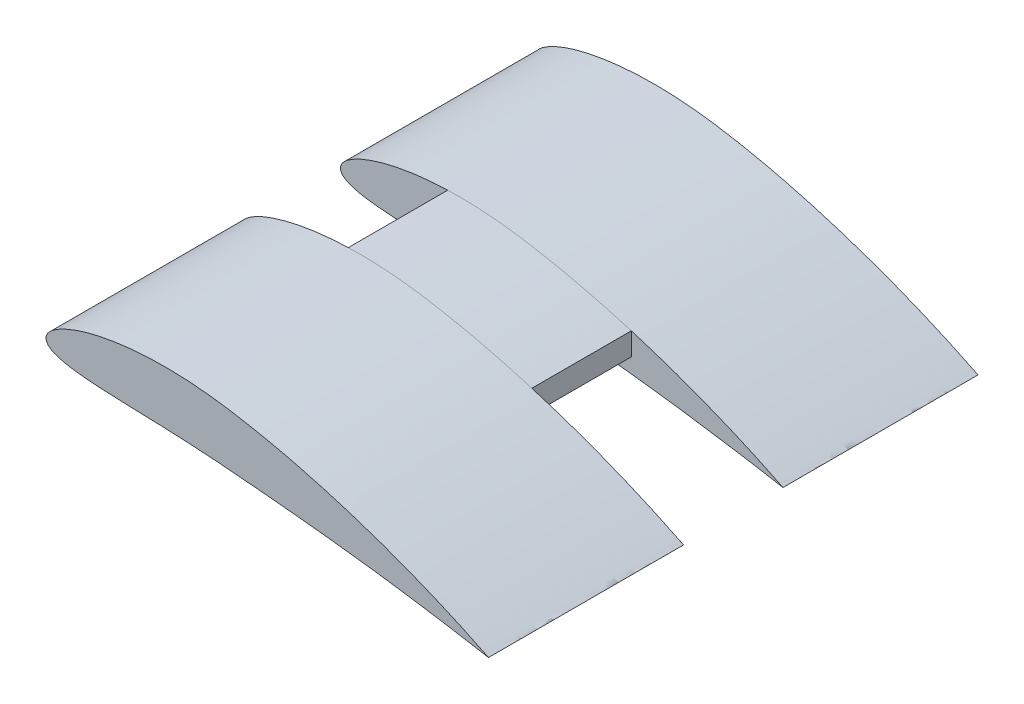
from build123d import *

# Parameters (mm, degrees)
BOSS_EXTRUDE1_DEPTH = 82.55
BOSS_EXTRUDE2_DEPTH = 161.89452


with BuildPart() as part:
    # Sketch1 → Boss-Extrude1 (new body)
    with BuildSketch(Plane.XY):
        with BuildLine():
            Line((-3993.743539522, 2773.608201053), (-3841.343539522, 2773.608201053))
            Line((-3841.343539522, 2773.608201053), (-3841.343539522, 2792.363073093))
            add(Edge.make_bspline(
                [(-3841.343539522, 2792.363073093), (-3841.711861468, 2792.475616482), (-3843.898147209, 2793.139845648), (-3847.938761536, 2794.31278849), (-3853.472864908, 2795.891023036), (-3859.079075872, 2797.42344512), (-3864.707929603, 2798.992199511), (-3870.397568873, 2800.456078804), (-3876.103362754, 2801.923710473), (-3881.85976437, 2803.269062489), (-3887.60919579, 2804.671294938), (-3893.388309583, 2805.981474488), (-3899.186195428, 2807.179502438), (-3904.973244797, 2808.465160501), (-3910.788849777, 2809.533249275), (-3916.567041698, 2810.702132551), (-3922.35292128, 2811.680462605), (-3928.135209061, 2812.655662979), (-3933.932038882, 2813.608093152), (-3939.746866514, 2814.432696682), (-3945.551445821, 2815.132456604), (-3951.325314239, 2815.783964506), (-3957.054165146, 2816.285275716), (-3962.72920324, 2816.737097742), (-3968.332746471, 2817.038778778), (-3973.884543713, 2817.285655167), (-3979.350600192, 2817.392068282), (-3984.740641178, 2817.418731072), (-3989.523163243, 2817.366108294), (-3992.516735346, 2817.295427096), (-3993.743539522, 2817.258430848)],
                knots=[5.335663708, 5.335663708, 5.335663708, 5.335663708, 5.381152202, 5.605544386, 5.832582956, 6.060842599, 6.291984469, 6.522722051, 6.754716119, 6.987809745, 7.220903371, 7.453687274, 7.687648663, 7.920158939, 8.153779967, 8.385947755, 8.616400073, 8.846783322, 9.078562345, 9.310217742, 9.540375223, 9.769094566, 9.996455352, 10.219562508, 10.441458488, 10.6592085, 10.875903506, 11.087123978, 11.295817799, 11.440780643, 11.440780643, 11.440780643, 11.440780643], degree=3))
            Line((-3993.743539522, 2817.258430848), (-3993.743539522, 2773.608201053))
        make_face()
    extrude(amount=BOSS_EXTRUDE1_DEPTH)

    # Sketch2 → Boss-Extrude2 (add)
    with BuildSketch(Plane.XY.offset(82.55)):
        with BuildLine():
            add(Edge.make_bspline(
                [(-3715.436692663, 2742.658848332), (-3715.437609335, 2742.666773834), (-3715.603849409, 2742.764013393), (-3715.833408452, 2742.801223623), (-3716.246202746, 2743.103979216), (-3716.853802493, 2743.319984643), (-3717.586011877, 2743.736484), (-3718.522621408, 2744.169507465), (-3719.599696152, 2744.729837417), (-3720.870653545, 2745.308632109), (-3722.273530629, 2746.027025893), (-3723.870469585, 2746.765070625), (-3725.609476187, 2747.62155415), (-3727.532282833, 2748.518616956), (-3729.580506516, 2749.53362412), (-3731.824076834, 2750.527251824), (-3734.181508013, 2751.664449519), (-3736.72577039, 2752.806706256), (-3739.394541469, 2754.098180123), (-3742.258057775, 2755.359163595), (-3745.252391245, 2756.690403657), (-3748.372150508, 2758.106658861), (-3751.674280115, 2759.485991386), (-3755.078756902, 2761.003310542), (-3758.632650605, 2762.5213757), (-3762.327411669, 2764.049273825), (-3766.1595969, 2765.634833977), (-3770.107526994, 2767.292334905), (-3774.212410323, 2768.887832121), (-3778.406632845, 2770.580894456), (-3782.739502018, 2772.256762989), (-3787.189260628, 2773.96155952), (-3791.740443158, 2775.669197532), (-3796.396152273, 2777.405363561), (-3801.150290176, 2779.144902086), (-3806.027585104, 2780.85325761), (-3810.979033111, 2782.589201908), (-3816.032990243, 2784.278778522), (-3821.165106035, 2785.992650493), (-3826.363028747, 2787.724895009), (-3831.673181627, 2789.369978836), (-3837.038047636, 2791.026623498), (-3842.451089299, 2792.719781747), (-3847.938761536, 2794.31278849), (-3853.472864908, 2795.891023036), (-3859.079075872, 2797.42344512), (-3864.707929603, 2798.992199511), (-3870.397568873, 2800.456078804), (-3876.103362754, 2801.923710473), (-3881.85976437, 2803.269062489), (-3887.60919579, 2804.671294938), (-3893.388309583, 2805.981474488), (-3899.186195428, 2807.179502438), (-3904.973244797, 2808.465160501), (-3910.788849777, 2809.533249275), (-3916.567041698, 2810.702132551), (-3922.35292128, 2811.680462605), (-3928.135209061, 2812.655662979), (-3933.932038882, 2813.608093152), (-3939.746866514, 2814.432696682), (-3945.551445821, 2815.132456604), (-3951.325314239, 2815.783964506), (-3957.054165146, 2816.285275716), (-3962.72920324, 2816.737097742), (-3968.332746471, 2817.038778778), (-3973.884543713, 2817.285655167), (-3979.350600192, 2817.392068282), (-3984.740641178, 2817.418731072), (-3990.041783459, 2817.360401841), (-3995.254405599, 2817.225940622), (-4000.365516307, 2816.991727704), (-4005.363762863, 2816.677547642), (-4010.245014186, 2816.264043814), (-4015.014701582, 2815.812057832), (-4019.656945224, 2815.270220489), (-4024.167873049, 2814.622873189), (-4028.541319597, 2813.93396536), (-4032.77114543, 2813.183156161), (-4036.850585349, 2812.394811872), (-4040.772284885, 2811.502922685), (-4044.565848523, 2810.667437583), (-4048.176566951, 2809.675999405), (-4051.626682759, 2808.676520185), (-4054.92167225, 2807.686870794), (-4058.018156144, 2806.594798563), (-4060.973317763, 2805.551305352), (-4063.723853742, 2804.442770109), (-4066.307679449, 2803.328381143), (-4068.710204732, 2802.232608386), (-4070.91451375, 2801.061840001), (-4072.945542301, 2799.923293053), (-4074.773257958, 2798.74180223), (-4076.441644791, 2797.633709418), (-4077.904402206, 2796.481929443), (-4079.181561235, 2795.362758377), (-4080.282480159, 2794.248649673), (-4081.158074614, 2793.125986768), (-4081.880232555, 2792.026675843), (-4082.334485118, 2790.914190765), (-4082.675143589, 2789.847944514), (-4082.823331978, 2788.784916078), (-4082.693948427, 2787.745624683), (-4082.470017408, 2786.723209354), (-4081.963493246, 2785.772955975), (-4081.310416715, 2784.869698158), (-4080.53298626, 2783.956933654), (-4079.478768088, 2783.195847775), (-4078.318638724, 2782.406301483), (-4076.971576454, 2781.680138735), (-4075.438337434, 2781.021302808), (-4073.743946394, 2780.362580504), (-4071.875255872, 2779.763631739), (-4069.836551565, 2779.226298141), (-4067.654411453, 2778.689981663), (-4065.297908408, 2778.224170365), (-4062.805148357, 2777.776856283), (-4060.153930142, 2777.309793714), (-4057.34348362, 2777.012349183), (-4054.397587882, 2776.611639585), (-4051.299903565, 2776.343992075), (-4048.073798842, 2775.988937986), (-4044.699770313, 2775.745763477), (-4041.201164235, 2775.495489926), (-4037.562419352, 2775.277846486), (-4033.809781089, 2775.069361521), (-4029.929759471, 2774.914330128), (-4025.951516816, 2774.685980795), (-4021.843421561, 2774.603484482), (-4017.640129952, 2774.38634525), (-4013.322285735, 2774.238650638), (-4008.915697589, 2774.113213914), (-4004.410233437, 2773.969362847), (-3999.818998096, 2773.817827403), (-3995.129268625, 2773.63796133), (-3990.351362878, 2773.522821667), (-3985.490322715, 2773.319757978), (-3980.556403337, 2773.125161383), (-3975.549409758, 2772.932447479), (-3970.485049678, 2772.668784743), (-3965.35964163, 2772.415325409), (-3960.173570853, 2772.159217275), (-3954.917773306, 2771.851566412), (-3949.618535179, 2771.479015467), (-3944.268525502, 2771.152747581), (-3938.868364942, 2770.685054128), (-3933.368695319, 2770.242875138), (-3927.797099884, 2769.772469606), (-3922.162141047, 2769.325174048), (-3916.510491013, 2768.784691317), (-3910.826122991, 2768.341446839), (-3905.149107932, 2767.813274955), (-3899.45862284, 2767.303176011), (-3893.755381857, 2766.800451542), (-3888.058120433, 2766.237622385), (-3882.372440611, 2765.687590059), (-3876.697333125, 2765.158241031), (-3871.043433957, 2764.540873624), (-3865.390569847, 2764.041117047), (-3859.790062512, 2763.395343498), (-3854.222482513, 2762.795747386), (-3848.693075112, 2762.186773331), (-3843.198953395, 2761.596716339), (-3837.759044339, 2760.966458817), (-3832.386236235, 2760.296687196), (-3827.073073742, 2759.647592597), (-3821.821887743, 2758.999703703), (-3816.654881231, 2758.37433753), (-3811.566126502, 2757.717170213), (-3806.572307188, 2757.002149767), (-3801.639195719, 2756.389827929), (-3796.803631927, 2755.700010429), (-3792.060037197, 2755.062579093), (-3787.424241076, 2754.365970239), (-3782.907793259, 2753.704276243), (-3778.502178456, 2753.051354127), (-3774.21974056, 2752.40868683), (-3770.043374728, 2751.803412061), (-3766.002879991, 2751.126433387), (-3762.068513312, 2750.566490612), (-3758.285685827, 2749.917984893), (-3754.633002328, 2749.390906009), (-3751.141444193, 2748.792231068), (-3747.791245673, 2748.243304586), (-3744.581545217, 2747.678564877), (-3741.515796769, 2747.224967846), (-3738.62751323, 2746.684477196), (-3735.879664041, 2746.270624167), (-3733.308655214, 2745.776649831), (-3730.883232672, 2745.380559319), (-3728.631413227, 2744.996229391), (-3726.555616757, 2744.609460979), (-3724.648257187, 2744.333123484), (-3722.93011121, 2743.979634377), (-3721.38089313, 2743.731206882), (-3720.006538868, 2743.48983683), (-3718.819181574, 2743.249129125), (-3717.803031963, 2743.119688576), (-3716.977797131, 2742.923868946), (-3716.35531812, 2742.79295806), (-3715.837707468, 2742.767139696), (-3715.640080082, 2742.689971076), (-3715.435462819, 2742.648215155), (-3715.436692663, 2742.658848332)],
                knots=[0, 0, 0, 0, 0.000108623, 0.000509205, 0.001140714, 0.001955024, 0.003092198, 0.004428746, 0.006026648, 0.007870041, 0.009928725, 0.012232966, 0.0147984, 0.017563488, 0.020589764, 0.02380067, 0.027226342, 0.030898055, 0.034784571, 0.038902513, 0.043220463, 0.047691983, 0.052396247, 0.05731436, 0.062372272, 0.067617085, 0.073062118, 0.078707377, 0.084480766, 0.09040744, 0.096522246, 0.1027784, 0.109176098, 0.115668262, 0.122349588, 0.129114976, 0.136022746, 0.143015567, 0.150103579, 0.157334474, 0.164594844, 0.171998595, 0.179450161, 0.186933171, 0.194504432, 0.202116413, 0.209824511, 0.217519126, 0.225255642, 0.233028827, 0.240802011, 0.248564867, 0.25636699, 0.264120721, 0.271911493, 0.279653803, 0.287338905, 0.295021704, 0.302751049, 0.310476272, 0.318151542, 0.325778853, 0.33336086, 0.340801016, 0.348200783, 0.35546229, 0.362688615, 0.369732375, 0.376691877, 0.383568834, 0.390269206, 0.396843183, 0.403293045, 0.409563139, 0.415713347, 0.421699448, 0.427511334, 0.433150738, 0.438619555, 0.443874032, 0.448991315, 0.45391662, 0.458617622, 0.463140565, 0.467463977, 0.471548257, 0.475483347, 0.479140894, 0.48263207, 0.485879514, 0.488969069, 0.491799108, 0.494449597, 0.496854069, 0.499125302, 0.50113644, 0.503010934, 0.504727726, 0.506295814, 0.507725352, 0.509134104, 0.510477695, 0.511830912, 0.513232106, 0.514676424, 0.516225587, 0.517925111, 0.519771701, 0.521756263, 0.523938476, 0.526341966, 0.52891429, 0.531662257, 0.534644941, 0.537763385, 0.541120871, 0.544621497, 0.548361977, 0.552248189, 0.556329869, 0.560605807, 0.565030643, 0.569651908, 0.574421432, 0.579388008, 0.58445501, 0.58971577, 0.595081348, 0.600636433, 0.606292341, 0.612097727, 0.617999862, 0.624047147, 0.630191213, 0.636484786, 0.642870854, 0.649353743, 0.655933461, 0.662606305, 0.6693276, 0.676145799, 0.683057668, 0.690063638, 0.697069607, 0.704167932, 0.711411869, 0.718801424, 0.726190978, 0.73367588, 0.741162515, 0.748647417, 0.756132318, 0.763665772, 0.771197816, 0.778681299, 0.786164781, 0.79364716, 0.801082081, 0.808515098, 0.815850968, 0.823138265, 0.830425561, 0.837615219, 0.844707557, 0.851751318, 0.858697923, 0.865547373, 0.872251266, 0.878907115, 0.885416702, 0.891829689, 0.898145532, 0.904268052, 0.910293444, 0.916124585, 0.921810039, 0.927349809, 0.932745429, 0.937945282, 0.943001094, 0.947861045, 0.952480012, 0.956953378, 0.961232626, 0.965315751, 0.969158302, 0.97280454, 0.976259023, 0.979468459, 0.982483798, 0.985256557, 0.987784463, 0.990072259, 0.992163357, 0.993963354, 0.995569358, 0.9969304, 0.998003515, 0.998879262, 0.999510771, 0.999854267, 1, 1, 1, 1], degree=3))
        make_face()
    boss_extrude2 = extrude(amount=BOSS_EXTRUDE2_DEPTH)

    # Mirror1: Boss-Extrude2 across plane
    add(boss_extrude2.mirror(Plane(origin=(0, 0, 41.275), x_dir=(1, 0, 0), z_dir=(0, 0, -1))))


solid = part.part
